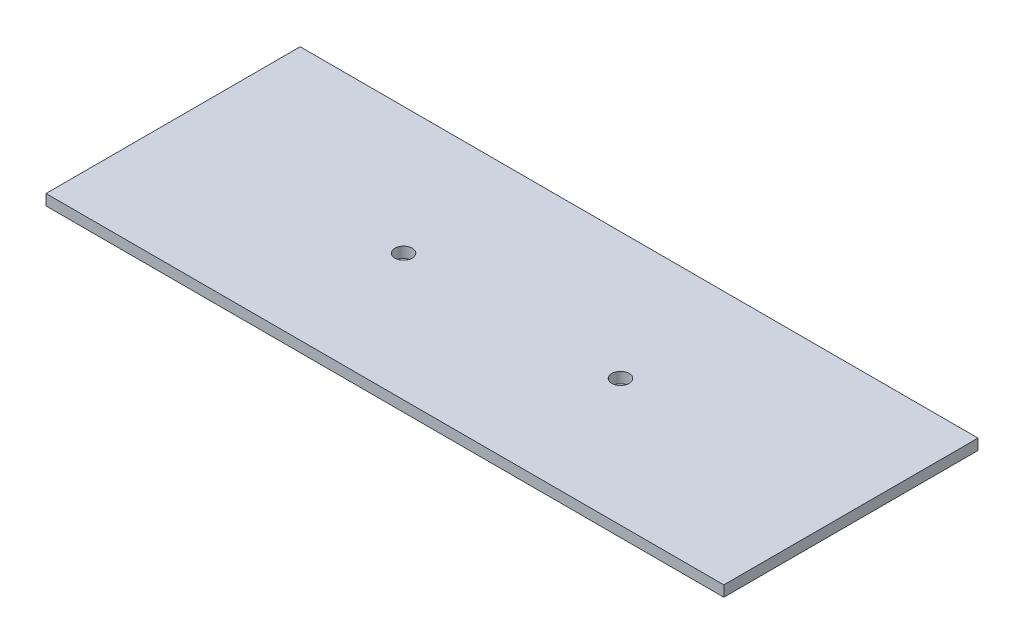
from build123d import *

# Parameters (mm, degrees)
SKETCH1_W           = 200
SKETCH1_H           = 75
BOSS_EXTRUDE1_DEPTH = 3.175
SKETCH2_R           = 2.5527
CUT_EXTRUDE1_DEPTH  = 107.84723031


with BuildPart() as part:
    # Sketch1 → Boss-Extrude1 (new body)
    with BuildSketch(Plane(origin=(0, 0, 0), x_dir=(1, 0, 0), z_dir=(0, 1, 0))):
        Rectangle(SKETCH1_W, SKETCH1_H)
    extrude(amount=BOSS_EXTRUDE1_DEPTH)

    # Sketch2 → Cut-Extrude1 (cut, through all)
    with BuildSketch(Plane(origin=(0, 3.175, 0), x_dir=(1, 0, 0), z_dir=(0, 1, 0))):
        with Locations(Location((32, 0, 0), (0, 0, 270))):
            Circle(SKETCH2_R)
        with Locations(Location((-32, 0, 0), (0, 0, 90))):
            Circle(SKETCH2_R)
    extrude(amount=-CUT_EXTRUDE1_DEPTH, mode=Mode.SUBTRACT)


solid = part.part
